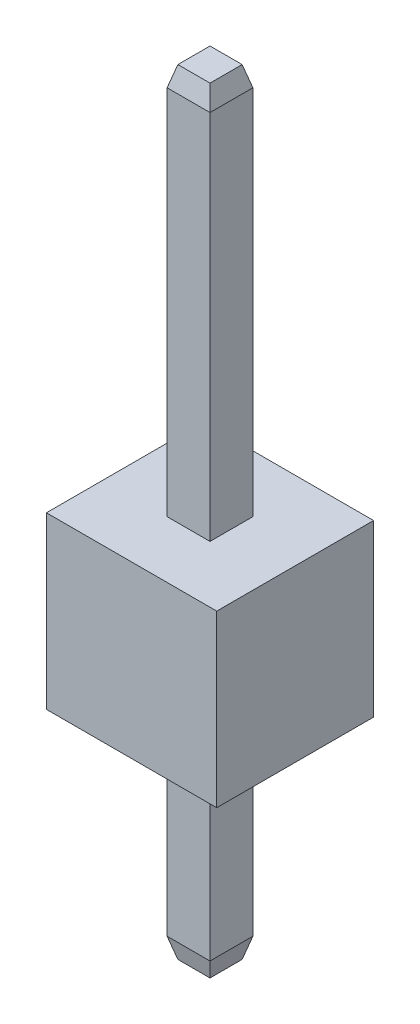
from build123d import *
from OCP.BRepFilletAPI import BRepFilletAPI_MakeChamfer

# Parameters (mm, degrees)
BOSS_EXTRUDE1_DEPTH      = 8.38
BOSS_EXTRUDE1_DEPTH_BACK = 3.18
SKETCH1_W                = 0.64
SKETCH1_H                = 0.64
SKETCH2_W                = 2.54
SKETCH2_H                = 2.34
BOSS_EXTRUDE2_DEPTH      = 2.54
CHAMFER1_SIZE            = 0.3
CHAMFER1_SIZE2           = 0.080384758


with BuildPart() as part:
    # Sketch1 → Boss-Extrude1 (new, two sides: drawn at the far end of the back side and taken through both)
    with BuildSketch(Plane(origin=(0, 0, 0), x_dir=(1, 0, 0), z_dir=(0, 1, 0)).offset(-BOSS_EXTRUDE1_DEPTH_BACK)):
        Rectangle(SKETCH1_W, SKETCH1_H)
    extrude(amount=BOSS_EXTRUDE1_DEPTH + BOSS_EXTRUDE1_DEPTH_BACK)

    # Sketch2 → Boss-Extrude2 (add)
    with BuildSketch(Plane(origin=(0, 0, 0), x_dir=(1, 0, 0), z_dir=(0, 1, 0))):
        Rectangle(SKETCH2_W, SKETCH2_H)
    extrude(amount=BOSS_EXTRUDE2_DEPTH)

    # Chamfer1: one chamfer whose edges measure the first distance from different faces: ONE call of the kernel's chamfer builder (chamfer() names one face for all edges)
    chamfer1_edges_1 = [part.edges().sort_by_distance(p)[0] for p in [
        (-0.32, 8.38, 0),
    ]]
    chamfer1_side_1 = [part.faces().sort_by_distance(p)[0] for p in [
        (-0.32, 5.46, 0),
    ]]
    chamfer1_edges_2 = [part.edges().sort_by_distance(p)[0] for p in [
        (0.32, -3.18, 0),
    ]]
    chamfer1_side_2 = [part.faces().sort_by_distance(p)[0] for p in [
        (0.32, -1.59, 0),
    ]]
    chamfer1_edges_3 = [part.edges().sort_by_distance(p)[0] for p in [
        (0, -3.18, 0.32),
    ]]
    chamfer1_side_3 = [part.faces().sort_by_distance(p)[0] for p in [
        (0, -1.59, 0.32),
    ]]
    chamfer1_edges_4 = [part.edges().sort_by_distance(p)[0] for p in [
        (-0.32, -3.18, 0),
    ]]
    chamfer1_side_4 = [part.faces().sort_by_distance(p)[0] for p in [
        (-0.32, -1.59, 0),
    ]]
    chamfer1_edges_5 = [part.edges().sort_by_distance(p)[0] for p in [
        (0, -3.18, -0.32),
    ]]
    chamfer1_side_5 = [part.faces().sort_by_distance(p)[0] for p in [
        (0, -1.59, -0.32),
    ]]
    chamfer1_edges_6 = [part.edges().sort_by_distance(p)[0] for p in [
        (0, 8.38, 0.32),
    ]]
    chamfer1_side_6 = [part.faces().sort_by_distance(p)[0] for p in [
        (0, 5.46, 0.32),
    ]]
    chamfer1_edges_7 = [part.edges().sort_by_distance(p)[0] for p in [
        (0.32, 8.38, 0),
    ]]
    chamfer1_side_7 = [part.faces().sort_by_distance(p)[0] for p in [
        (0.32, 5.46, 0),
    ]]
    chamfer1_edges_8 = [part.edges().sort_by_distance(p)[0] for p in [
        (0, 8.38, -0.32),
    ]]
    chamfer1_side_8 = [part.faces().sort_by_distance(p)[0] for p in [
        (0, 5.46, -0.32),
    ]]
    chamfer1 = BRepFilletAPI_MakeChamfer(part.part.solid().wrapped)
    for e in chamfer1_edges_1:
        chamfer1.Add(CHAMFER1_SIZE, CHAMFER1_SIZE2, e.wrapped, chamfer1_side_1[0].wrapped)  # the first distance lies on this face
    for e in chamfer1_edges_2:
        chamfer1.Add(CHAMFER1_SIZE, CHAMFER1_SIZE2, e.wrapped, chamfer1_side_2[0].wrapped)  # the first distance lies on this face
    for e in chamfer1_edges_3:
        chamfer1.Add(CHAMFER1_SIZE, CHAMFER1_SIZE2, e.wrapped, chamfer1_side_3[0].wrapped)  # the first distance lies on this face
    for e in chamfer1_edges_4:
        chamfer1.Add(CHAMFER1_SIZE, CHAMFER1_SIZE2, e.wrapped, chamfer1_side_4[0].wrapped)  # the first distance lies on this face
    for e in chamfer1_edges_5:
        chamfer1.Add(CHAMFER1_SIZE, CHAMFER1_SIZE2, e.wrapped, chamfer1_side_5[0].wrapped)  # the first distance lies on this face
    for e in chamfer1_edges_6:
        chamfer1.Add(CHAMFER1_SIZE, CHAMFER1_SIZE2, e.wrapped, chamfer1_side_6[0].wrapped)  # the first distance lies on this face
    for e in chamfer1_edges_7:
        chamfer1.Add(CHAMFER1_SIZE, CHAMFER1_SIZE2, e.wrapped, chamfer1_side_7[0].wrapped)  # the first distance lies on this face
    for e in chamfer1_edges_8:
        chamfer1.Add(CHAMFER1_SIZE, CHAMFER1_SIZE2, e.wrapped, chamfer1_side_8[0].wrapped)  # the first distance lies on this face
    add(Compound.cast(chamfer1.Shape()), mode=Mode.REPLACE)


solid = part.part
